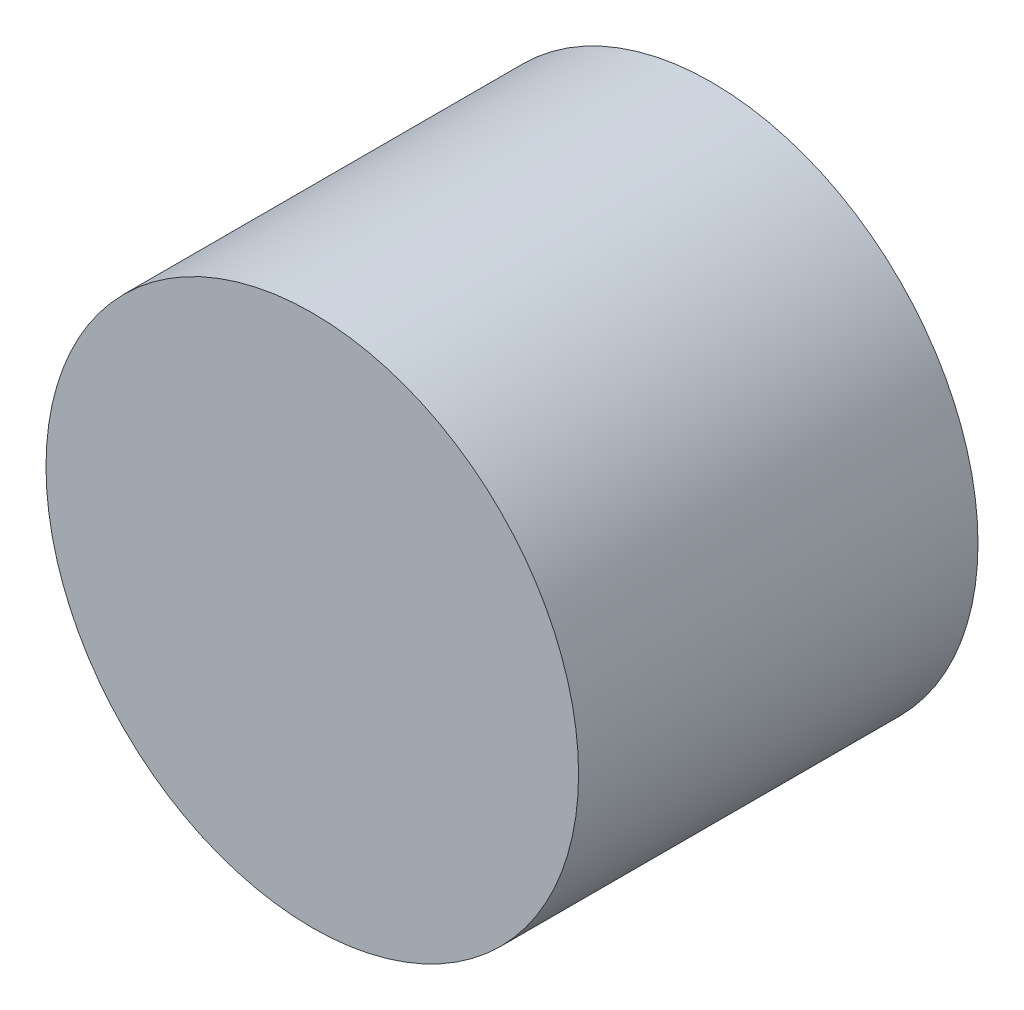
from build123d import *

# Parameters (mm, degrees)
SKETCH1_R      = 50.8
EXTRUDE1_DEPTH = 76.2


with BuildPart() as part:
    # Sketch1 → Extrude1 (new body)
    with BuildSketch(Plane.XY):
        with Locations(Location((0, 0, 0), (0, 0, 180))):
            Circle(SKETCH1_R)
    extrude(amount=EXTRUDE1_DEPTH)


solid = part.part
